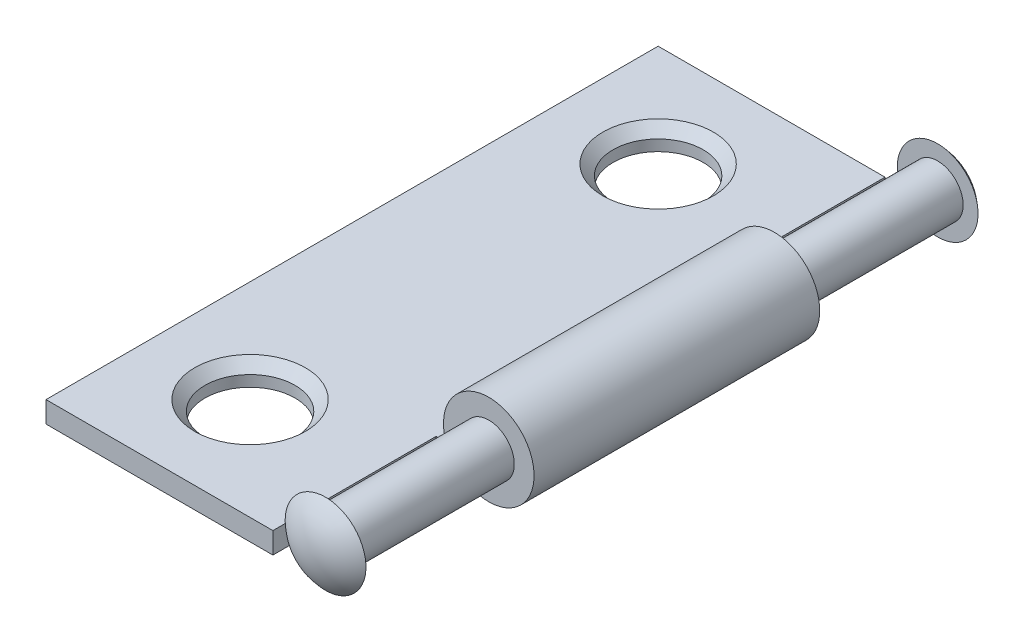
from build123d import *

# Parameters (mm, degrees)
SKETCH2_R                       = 2.8194
SKETCH2_R_2                     = 1.5875
BOSS_EXTRUDE1_DEPTH             = 19.05
BOSS_EXTRUDE2_REACH             = 21.463
BOSS_EXTRUDE2_DIRECTION_2_REACH = 21.463
FILLET1_R                       = 2.54
CUT_EXTRUDE1_START              = 8.89
SKETCH4_W                       = 6.5532
SKETCH4_H                       = 6.5532
CUT_EXTRUDE1_DEPTH              = 18.063356572
CUT_EXTRUDE2_START              = -8.89
SKETCH4_2_W                     = 6.5532
SKETCH4_2_H                     = 6.5532
CUT_EXTRUDE2_DEPTH              = 18.063356572
F_10_CLEARANCE_HOLE1_AT_2_COUNT = 2
F_10_CLEARANCE_HOLE1_AT_2_PITCH = 25.4


with BuildPart() as part:
    # Sketch2 → Boss-Extrude1 (new, symmetric)
    with BuildSketch(Plane.XY):
        Circle(SKETCH2_R)
        Circle(SKETCH2_R_2, mode=Mode.SUBTRACT)
    extrude(amount=BOSS_EXTRUDE1_DEPTH, both=True)

    # Boss-Extrude2: up to this face of the body (flat: up to its plane)
    boss_extrude2_end = Plane(part.part.faces().sort_by_distance((-2.739655326, 0, 19.05))[0])
    # Sketch3 → Boss-Extrude2 (add, up to the picked face)
    with BuildSketch(Plane.XY, mode=Mode.PRIVATE) as boss_extrude2_sk1:
        with BuildLine():
            Line((-1.701752611, -2.2479), (-17.399, -2.2479))
            Line((-17.399, -2.2479), (-17.399, -0.9271))
            Line((-17.399, -0.9271), (-2.662611866, -0.9271))
            ThreePointArc((-2.662611866, -0.9271), (-2.279922692, -1.658604497), (-1.701752611, -2.2479))
        make_face()
    boss_extrude2_tool1 = split(extrude(boss_extrude2_sk1.sketch, amount=BOSS_EXTRUDE2_REACH, mode=Mode.PRIVATE), bisect_by=boss_extrude2_end, keep=Keep.BOTH, mode=Mode.PRIVATE)
    add(boss_extrude2_tool1.solids().sort_by(Axis((-9.838158, -1.594307, 0), (0, 0, 1)))[0])

    # Boss-Extrude2 direction 2: up to this face of the body (flat: up to its plane)
    boss_extrude2_direction_2_end = Plane(part.part.faces().sort_by_distance((-2.739655326, 0, -19.05))[0])
    # Sketch3 → Boss-Extrude2 direction 2 (add, up to the picked face)
    with BuildSketch(Plane.XY, mode=Mode.PRIVATE) as boss_extrude2_direction_2_sk1:
        with BuildLine():
            Line((-1.701752611, -2.2479), (-17.399, -2.2479))
            Line((-17.399, -2.2479), (-17.399, -0.9271))
            Line((-17.399, -0.9271), (-2.662611866, -0.9271))
            ThreePointArc((-2.662611866, -0.9271), (-2.279922692, -1.658604497), (-1.701752611, -2.2479))
        make_face()
    boss_extrude2_direction_2_tool1 = split(extrude(boss_extrude2_direction_2_sk1.sketch, amount=-BOSS_EXTRUDE2_DIRECTION_2_REACH, mode=Mode.PRIVATE), bisect_by=boss_extrude2_direction_2_end, keep=Keep.BOTH, mode=Mode.PRIVATE)
    add(boss_extrude2_direction_2_tool1.solids().sort_by(Axis((-9.838158, -1.594307, 0), (0, 0, -1)))[0])

    # Fillet1
    fillet1_edges = [part.edges().sort_by_distance(p)[0] for p in [
        (-1.701752611, -2.2479, 0),
    ]]
    fillet(fillet1_edges, radius=FILLET1_R)

    # Sketch4 → Cut-Extrude1 (cut, through all)
    with BuildSketch(Plane.XY.offset(CUT_EXTRUDE1_START)):
        Rectangle(SKETCH4_W, SKETCH4_H)
    extrude(amount=CUT_EXTRUDE1_DEPTH, mode=Mode.SUBTRACT)

    # Sketch4<2> → Cut-Extrude2 (cut, through all)
    with BuildSketch(Plane.XY.offset(CUT_EXTRUDE2_START)):
        Rectangle(SKETCH4_2_W, SKETCH4_2_H)
    extrude(amount=-CUT_EXTRUDE2_DEPTH, mode=Mode.SUBTRACT)

    # Sketch6 → #10 Clearance Hole1 (revolve, cut)
    with BuildSketch(Plane(origin=(-11.049, -0.9271, -12.7), x_dir=(0, 0, 1), z_dir=(1, 0, 0))):
        Polygon((0, 0), (0, 1.8923), (2.8067, 1.8923), (2.8067, 0.635), (3.4417, 0), align=None)
    f_10_clearance_hole1 = revolve(axis=Axis((-11.049, 5.4229, -12.7), (0, -1, 0)), mode=Mode.SUBTRACT)

    # #10 Clearance Hole1 at 2: #10 Clearance Hole1 ×2
    with Locations(*[(0, 0, i * F_10_CLEARANCE_HOLE1_AT_2_PITCH) for i in range(1, F_10_CLEARANCE_HOLE1_AT_2_COUNT)]):
        add(f_10_clearance_hole1, mode=Mode.SUBTRACT)


with BuildPart() as body_2:
    # Sketch8 → Revolve1 (revolve)
    with BuildSketch(Plane(origin=(0, 0, 0), x_dir=(1, 0, 0), z_dir=(0, 1, 0))):
        with BuildLine():
            Line((0, 20.066), (0, -20.066))
            ThreePointArc((0, -20.066), (-1.35604841, -19.802402315), (-2.5146, -19.05))
            Line((-2.5146, -19.05), (-1.5875, -19.05))
            Line((-1.5875, -19.05), (-1.5875, 19.05))
            Line((-1.5875, 19.05), (-2.5146, 19.05))
            ThreePointArc((-2.5146, 19.05), (-1.35604841, 19.802402315), (0, 20.066))
        make_face()
    revolve(axis=Axis((0, 0, -20.066), (0, 0, 1)))


solid = Compound([part.part, body_2.part])
